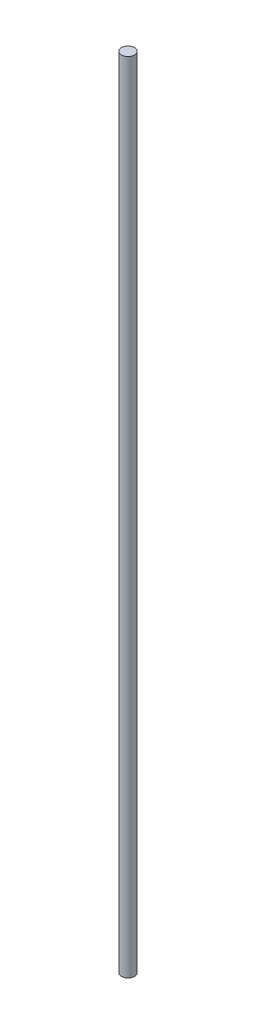
from build123d import *

# Parameters (mm, degrees)
SKETCH1_R           = 2.65
BOSS_EXTRUDE1_DEPTH = 326


with BuildPart() as part:
    # Sketch1 → Boss-Extrude1 (new body)
    with BuildSketch(Plane(origin=(0, 0, 0), x_dir=(1, 0, 0), z_dir=(0, 1, 0))):
        with Locations(Location((0, 0, 0), (0, 0, 270))):
            Circle(SKETCH1_R)
    extrude(amount=BOSS_EXTRUDE1_DEPTH)


solid = part.part
